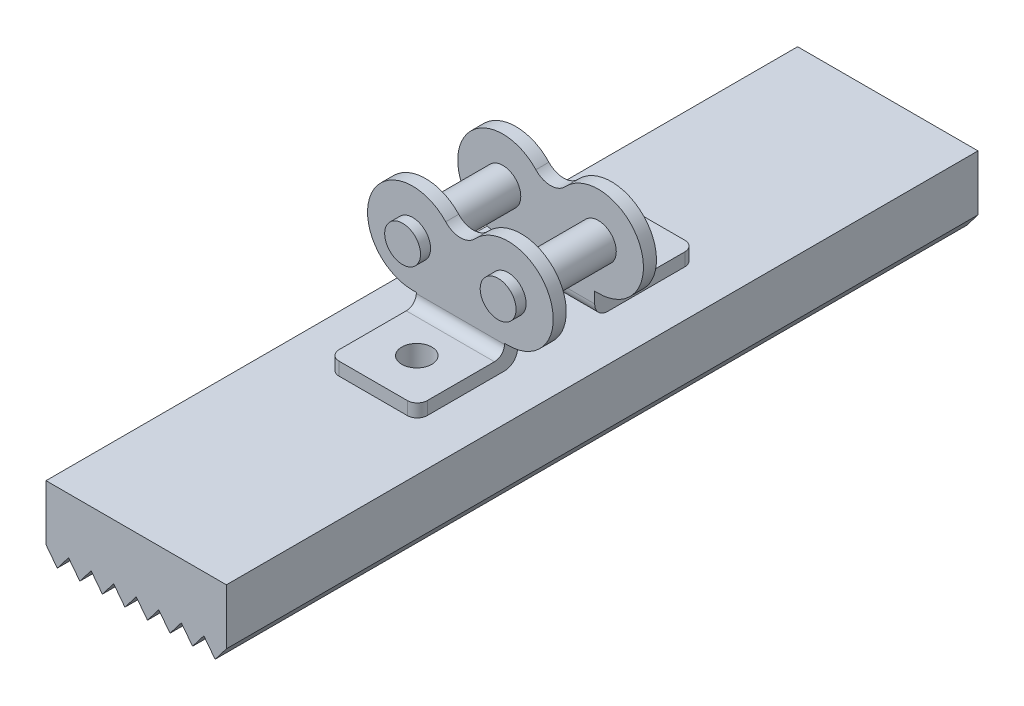
from build123d import *
from build123d.topology import SkipClean

# Parameters (mm, degrees)
BOSS_EXTRUDE1_DEPTH      = 1.3
BOSS_EXTRUDE2_DEPTH      = 10
BOSS_EXTRUDE2_DEPTH_BACK = 2.3
SKETCH2_R                = 1.79
SKETCH4_W                = 8.8
SKETCH4_H                = 1.3
BOSS_EXTRUDE4_DEPTH      = 2.4
SKETCH3_W                = 8.8
SKETCH3_H                = 10
BOSS_EXTRUDE3_DEPTH      = 1.3
FILLET4_R                = 1.3
FILLET6_R                = 1
SKETCH5_R                = 1.5
CUT_EXTRUDE1_DEPTH       = 2.4
FILLET7_R                = 1
FILLET4_OF_MIRROR1_R     = 1.3
FILLET6_OF_MIRROR1_R     = 1
FILLET7_OF_MIRROR1_R     = 1
BOSS_EXTRUDE5_START      = 7
SKETCH6_W                = 18
SKETCH6_H                = 75
SKETCH6_R                = 1.5
BOSS_EXTRUDE5_DEPTH      = 7
SKETCH9_R                = 4
CUT_EXTRUDE3_DEPTH       = 3
CUT_EXTRUDE4_DEPTH       = 77.837817675


with BuildPart() as part:
    # Sketch1 → Boss-Extrude1 (new body)
    with BuildSketch(Plane.XY):
        with BuildLine():
            Line((-4.765, -4.5), (4.765, -4.5))
            ThreePointArc((4.765, -4.5), (8.889497011, 1.799590065), (1.466153846, 3.060655821))
            ThreePointArc((1.466153846, 3.060655821), (0, 2.420947297), (-1.466153846, 3.060655821))
            ThreePointArc((-1.466153846, 3.060655821), (-8.889497011, 1.799590065), (-4.765, -4.5))
        make_face()
    boss_extrude1 = extrude(amount=BOSS_EXTRUDE1_DEPTH)

    # Sketch2 → Boss-Extrude2 (add, two sides: drawn at the far end of the back side and taken through both)
    with BuildSketch(Plane.XY.offset(1.3).offset(-BOSS_EXTRUDE2_DEPTH_BACK)):
        with Locations((-4.765, 0)):
            Circle(SKETCH2_R)
        with Locations((4.765, 0)):
            Circle(SKETCH2_R)
    extrude(amount=BOSS_EXTRUDE2_DEPTH + BOSS_EXTRUDE2_DEPTH_BACK)

    # Sketch4 → Boss-Extrude4 (add)
    with BuildSketch(Plane.XZ.offset(4.5)):
        with Locations((0, 0.65)):
            Rectangle(SKETCH4_W, SKETCH4_H)
    boss_extrude4 = extrude(amount=BOSS_EXTRUDE4_DEPTH)

    # Sketch3 → Boss-Extrude3 (add)
    with BuildSketch(Plane.XZ.offset(6.9)):
        with Locations((0, -3.7)):
            Rectangle(SKETCH3_W, SKETCH3_H)
    boss_extrude3 = extrude(amount=-BOSS_EXTRUDE3_DEPTH)

    # Fillet4
    fillet4_edges = [part.edges().sort_by_distance(p)[0] for p in [
        (0, -6.9, 1.3),
    ]]
    fillet(fillet4_edges, radius=FILLET4_R)

    # Fillet6
    fillet6_edges = [part.edges().sort_by_distance(p)[0] for p in [
        (0, -5.6, 0),
    ]]
    fillet(fillet6_edges, radius=FILLET6_R)

    # Sketch5 → Cut-Extrude1 (cut)
    with BuildSketch(Plane.XZ.offset(6.9)):
        with Locations(Location((0, -4.35, 0), (0, 0, 270))):
            Circle(SKETCH5_R)
    cut_extrude1 = extrude(amount=-CUT_EXTRUDE1_DEPTH, mode=Mode.SUBTRACT)

    # Fillet7
    fillet7_edges = [part.edges().sort_by_distance(p)[0] for p in [
        (-4.4, -6.25, -8.7),
        (4.4, -6.25, -8.7),
    ]]
    fillet(fillet7_edges, radius=FILLET7_R)

    # Mirror1: Boss-Extrude1, Boss-Extrude4, Boss-Extrude3, Cut-Extrude1 across plane
    add(boss_extrude1.mirror(Plane(origin=(0, 0, 5.15), x_dir=(1, 0, 0), z_dir=(0, 0, -1))))
    add(boss_extrude4.mirror(Plane(origin=(0, 0, 5.15), x_dir=(1, 0, 0), z_dir=(0, 0, -1))))
    add(boss_extrude3.mirror(Plane(origin=(0, 0, 5.15), x_dir=(1, 0, 0), z_dir=(0, 0, -1))))
    add(cut_extrude1.mirror(Plane(origin=(0, 0, 5.15), x_dir=(1, 0, 0), z_dir=(0, 0, -1))), mode=Mode.SUBTRACT)

    # Fillet4 of Mirror1
    fillet4_of_mirror1_edges = [part.edges().sort_by_distance(p)[0] for p in [
        (0, -6.9, 9),
    ]]
    fillet(fillet4_of_mirror1_edges, radius=FILLET4_OF_MIRROR1_R)

    # Fillet6 of Mirror1
    fillet6_of_mirror1_edges = [part.edges().sort_by_distance(p)[0] for p in [
        (0, -5.6, 10.3),
    ]]
    fillet(fillet6_of_mirror1_edges, radius=FILLET6_OF_MIRROR1_R)

    # Fillet7 of Mirror1
    fillet7_of_mirror1_edges = [part.edges().sort_by_distance(p)[0] for p in [
        (-4.4, -6.25, 19),
        (4.4, -6.25, 19),
    ]]
    fillet(fillet7_of_mirror1_edges, radius=FILLET7_OF_MIRROR1_R)

    # Sketch6 → Boss-Extrude5 (add)
    with SkipClean():  # the faces are left unmerged after this step: merging them gives an invalid solid
        with BuildSketch(Plane.XZ.offset(6.9).offset(BOSS_EXTRUDE5_START)):
            with Locations((0, 5.15)):
                Rectangle(SKETCH6_W, SKETCH6_H)
            with Locations(Location((0, 14.65, 0), (0, 0, 270))):
                Circle(SKETCH6_R, mode=Mode.SUBTRACT)
            with Locations(Location((0, -4.35, 0), (0, 0, 270))):
                Circle(SKETCH6_R, mode=Mode.SUBTRACT)
        extrude(amount=-BOSS_EXTRUDE5_DEPTH)

    # Sketch9 → Cut-Extrude3 (cut)
    with SkipClean():  # the faces are left unmerged after this step: merging them gives an invalid solid
        with BuildSketch(Plane.XZ.offset(13.9)):
            with Locations(Location((0, 14.65, 0), (0, 0, 270))):
                Circle(SKETCH9_R)
            with Locations(Location((0, -4.35, 0), (0, 0, 270))):
                Circle(SKETCH9_R)
        extrude(amount=-CUT_EXTRUDE3_DEPTH, mode=Mode.SUBTRACT)

    # Sketch11 → Cut-Extrude4 (cut, through all)
    with SkipClean():  # the faces are left unmerged after this step: merging them gives an invalid solid
        with BuildSketch(Plane.XY.offset(42.65)):
            Polygon((9, -12.432975638), (7.875, -13.9), (6.75, -12.432975638), (5.625, -13.9), (4.5, -12.432975638), (3.375, -13.9), (2.25, -12.432975638), (1.125, -13.9), (0, -12.432975638), (-1.125, -13.9), (-2.25, -12.432975638), (-3.375, -13.9), (-4.5, -12.432975638), (-5.625, -13.9), (-6.75, -12.432975638), (-7.875, -13.9), (-9, -12.432975638), (-9, -14.9), (9, -14.9), align=None)
        extrude(amount=-CUT_EXTRUDE4_DEPTH, mode=Mode.SUBTRACT)


solid = part.part
